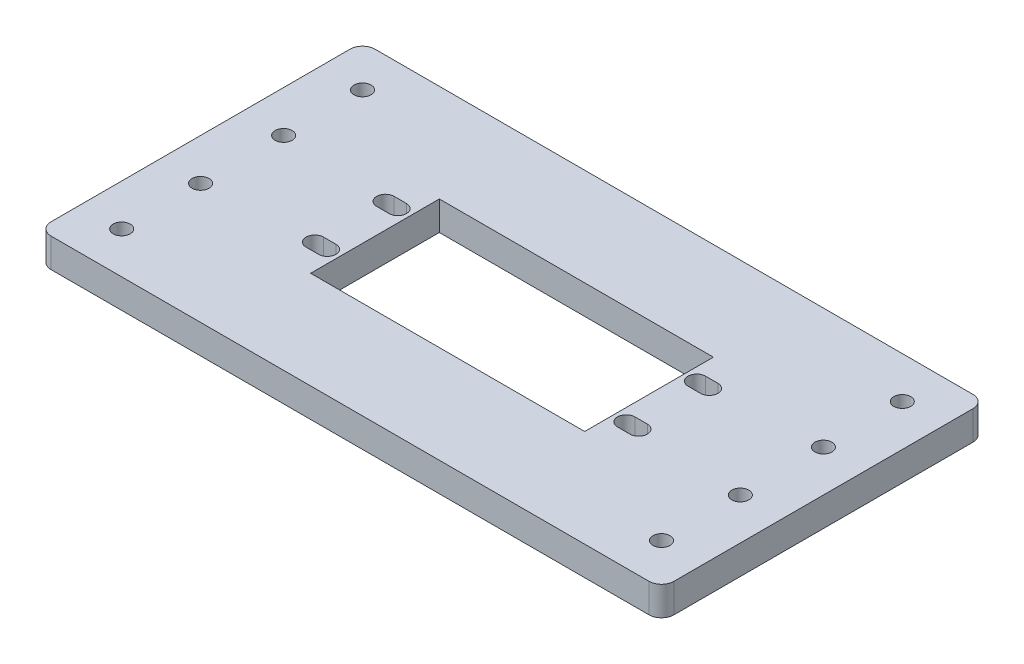
from build123d import *

# Parameters (mm, degrees)
SKETCH2_W           = 150
SKETCH2_H           = 78
SKETCH2_W_2         = 66
SKETCH2_H_2         = 31
BOSS_EXTRUDE1_DEPTH = 7
FILLET1_R           = 3
SKETCH3_R           = 2.05
CUT_EXTRUDE1_DEPTH  = 10


with BuildPart() as part:
    # Sketch2 → Boss-Extrude1 (new body)
    with BuildSketch(Plane(origin=(0, 0, 0), x_dir=(1, 0, 0), z_dir=(0, 1, 0))):
        Rectangle(SKETCH2_W, SKETCH2_H)
        Rectangle(SKETCH2_W_2, SKETCH2_H_2, mode=Mode.SUBTRACT)
        with BuildLine():
            Line((-39, 10.6), (-36, 10.6))
            ThreePointArc((-36, 10.6), (-33.9, 8.5), (-36, 6.4))
            Line((-36, 6.4), (-39, 6.4))
            ThreePointArc((-39, 6.4), (-41.1, 8.5), (-39, 10.6))
        make_face(mode=Mode.SUBTRACT)
        with BuildLine():
            Line((-39, -10.6), (-36, -10.6))
            ThreePointArc((-36, -10.6), (-33.9, -8.5), (-36, -6.4))
            Line((-36, -6.4), (-39, -6.4))
            ThreePointArc((-39, -6.4), (-41.1, -8.5), (-39, -10.6))
        make_face(mode=Mode.SUBTRACT)
        with BuildLine():
            Line((39, -10.6), (36, -10.6))
            ThreePointArc((36, -10.6), (33.9, -8.5), (36, -6.4))
            Line((36, -6.4), (39, -6.4))
            ThreePointArc((39, -6.4), (41.1, -8.5), (39, -10.6))
        make_face(mode=Mode.SUBTRACT)
        with BuildLine():
            Line((39, 10.6), (36, 10.6))
            ThreePointArc((36, 10.6), (33.9, 8.5), (36, 6.4))
            Line((36, 6.4), (39, 6.4))
            ThreePointArc((39, 6.4), (41.1, 8.5), (39, 10.6))
        make_face(mode=Mode.SUBTRACT)
    extrude(amount=BOSS_EXTRUDE1_DEPTH)

    # Fillet1
    fillet1_edges = [part.edges().sort_by_distance(p)[0] for p in [
        (75, 3.5, 39),
        (-75, 3.5, 39),
        (-75, 3.5, -39),
        (75, 3.5, -39),
    ]]
    fillet(fillet1_edges, radius=FILLET1_R)

    # Sketch3 → Cut-Extrude1 (cut)
    with BuildSketch(Plane(origin=(0, 7, 0), x_dir=(1, 0, 0), z_dir=(0, 1, 0))):
        with Locations(Location((-65, 10, 0), (0, 0, 270))):
            Circle(SKETCH3_R)
        with Locations(Location((-65, 29, 0), (0, 0, 270))):
            Circle(SKETCH3_R)
        with Locations(Location((-65, -10, 0), (0, 0, 270))):
            Circle(SKETCH3_R)
        with Locations(Location((-65, -29, 0), (0, 0, 270))):
            Circle(SKETCH3_R)
        with Locations(Location((65, -29, 0), (0, 0, 270))):
            Circle(SKETCH3_R)
        with Locations(Location((65, -10, 0), (0, 0, 270))):
            Circle(SKETCH3_R)
        with Locations(Location((65, 10, 0), (0, 0, 270))):
            Circle(SKETCH3_R)
        with Locations(Location((65, 29, 0), (0, 0, 270))):
            Circle(SKETCH3_R)
    extrude(amount=-CUT_EXTRUDE1_DEPTH, mode=Mode.SUBTRACT)


solid = part.part
